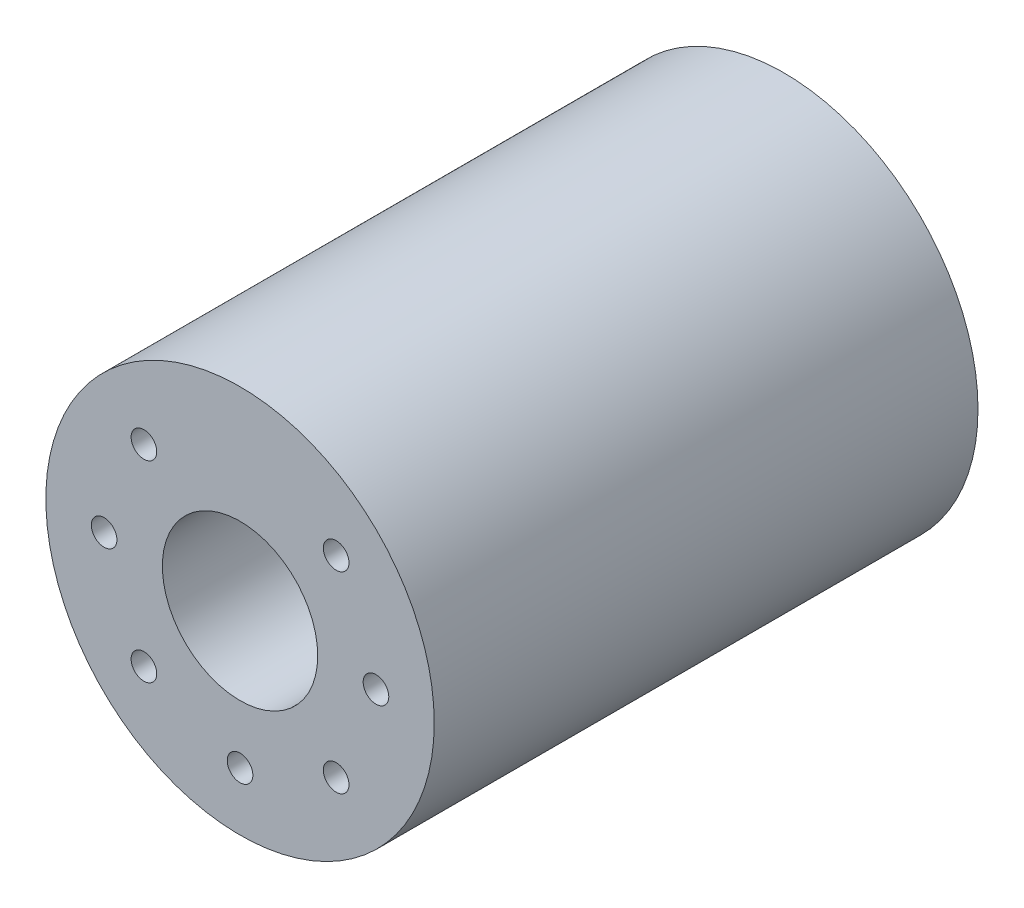
from build123d import *

# Parameters (mm, degrees)
SKETCH1_R           = 25
SKETCH1_R_2         = 10
BOSS_EXTRUDE1_DEPTH = 70
SKETCH3_R           = 1.65
CUT_EXTRUDE1_DEPTH  = 20
CUT_EXTRUDE2_START  = -20
SKETCH4_R           = 1.65
CUT_EXTRUDE2_DEPTH  = 20


with BuildPart() as part:
    # Sketch1 → Boss-Extrude1 (new body)
    with BuildSketch(Plane.XY):
        Circle(SKETCH1_R)
        Circle(SKETCH1_R_2, mode=Mode.SUBTRACT)
    extrude(amount=BOSS_EXTRUDE1_DEPTH)

    # Sketch3 → Cut-Extrude1 (cut)
    with BuildSketch(Plane.XY.offset(70)):
        with Locations((12.374368671, 12.374368671)):
            Circle(SKETCH3_R)
        with Locations((17.5, 0)):
            Circle(SKETCH3_R)
        with Locations((12.374368671, -12.374368671)):
            Circle(SKETCH3_R)
        with Locations((0, -17.5)):
            Circle(SKETCH3_R)
        with Locations((-12.374368671, -12.374368671)):
            Circle(SKETCH3_R)
        with Locations((-17.5, 0)):
            Circle(SKETCH3_R)
        with Locations((-12.374368671, 12.374368671)):
            Circle(SKETCH3_R)
    extrude(amount=-CUT_EXTRUDE1_DEPTH, mode=Mode.SUBTRACT)

    # Sketch4 → Cut-Extrude2 (cut)
    with BuildSketch(Plane(origin=(0, 0, 0), x_dir=(-1, 0, 0), z_dir=(0, 0, -1)).offset(CUT_EXTRUDE2_START)):
        with Locations((0, 17.5)):
            Circle(SKETCH4_R)
        with Locations(Location((12.374368671, 12.374368671, 0), (0, 0, 180))):
            Circle(SKETCH4_R)
        with Locations(Location((17.5, 0, 0), (0, 0, 180))):
            Circle(SKETCH4_R)
        with Locations(Location((12.374368671, -12.374368671, 0), (0, 0, 180))):
            Circle(SKETCH4_R)
        with Locations(Location((0, -17.5, 0), (0, 0, 180))):
            Circle(SKETCH4_R)
        with Locations(Location((-12.374368671, -12.374368671, 0), (0, 0, 180))):
            Circle(SKETCH4_R)
        with Locations(Location((-17.5, 0, 0), (0, 0, 180))):
            Circle(SKETCH4_R)
        with Locations(Location((-12.374368671, 12.374368671, 0), (0, 0, 180))):
            Circle(SKETCH4_R)
    extrude(amount=CUT_EXTRUDE2_DEPTH, mode=Mode.SUBTRACT)


solid = part.part
